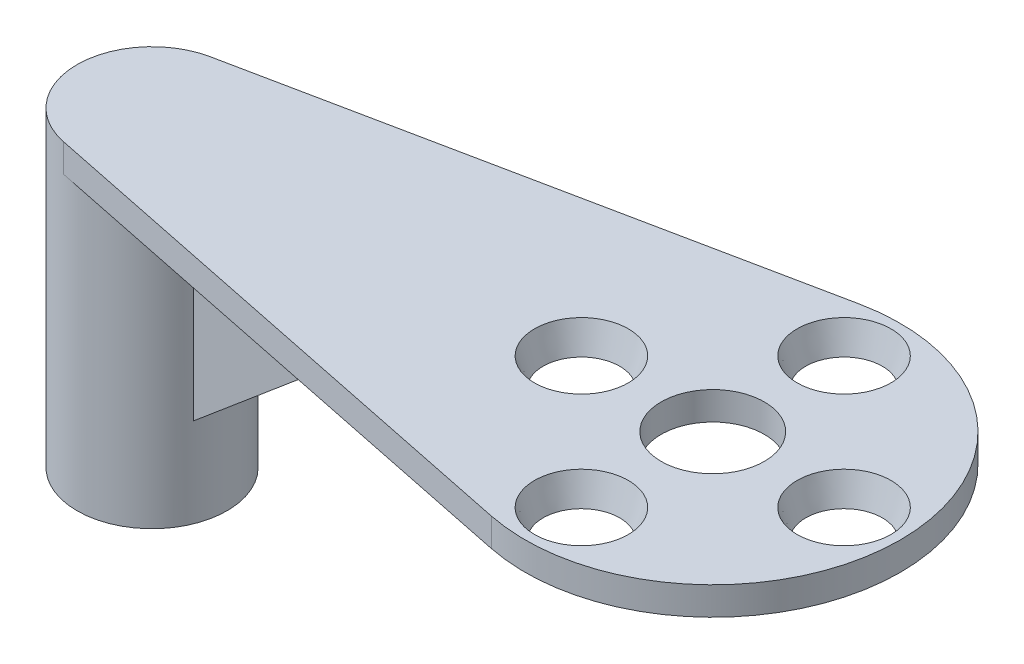
from build123d import *
from build123d.topology import SkipClean

# Parameters (mm, degrees)
CROQUIS1_R                      = 1.6
CROQUIS1_R_2                    = 2.75
SALIENTE_EXTRUIR1_DEPTH         = 1.5
SALIENTE_EXTRUIR3_START         = 15.1
CROQUIS3_R                      = 4
SALIENTE_EXTRUIR3_DEPTH         = 15.1
CROQUIS4_R                      = 3.1
CORTAR_EXTRUIR1_DEPTH           = 7.87
SALIENTE_EXTRUIR4_START         = -0.85
CROQUIS4_3_R                    = 3.1
CROQUIS4_3_R_2                  = 2.5
SALIENTE_EXTRUIR4_DEPTH         = 6.17
CROQUIS5_R                      = 2.5
CORTAR_EXTRUIR3_DEPTH           = 1.5
CORTAR_EXTRUIR3_DRAFT           = -17
CORTAR_EXTRUIR3_PROFILE_2_DEPTH = 1.5
CORTAR_EXTRUIR3_PROFILE_2_DRAFT = -17
CORTAR_EXTRUIR3_PROFILE_3_DEPTH = 1.5
CORTAR_EXTRUIR3_PROFILE_3_DRAFT = -17
CORTAR_EXTRUIR3_PROFILE_4_DEPTH = 1.5
CORTAR_EXTRUIR3_PROFILE_4_DRAFT = -17
NERVIO1_REACH                   = 45.809
CROQUIS6_WALL_W                 = 105.302560272
CROQUIS6_WALL_H                 = 3


with BuildPart() as part:
    # Croquis1 → Saliente-Extruir1 (new body)
    with BuildSketch(Plane(origin=(0, 0, 0), x_dir=(1, 0, 0), z_dir=(0, 1, 0))):
        with BuildLine():
            Line((-0.802944128, 3.918581469), (27.882639679, 9.796453672))
            ThreePointArc((27.882639679, 9.796453672), (39.89, 0), (27.882639679, -9.796453672))
            Line((27.882639679, -9.796453672), (-0.802944128, -3.918581469))
            ThreePointArc((-0.802944128, -3.918581469), (-4, 0), (-0.802944128, 3.918581469))
        make_face()
        with Locations(Location((29.89, 7, 0), (0, 0, 270))):
            Circle(CROQUIS1_R, mode=Mode.SUBTRACT)
        with Locations(Location((36.89, 0, 0), (0, 0, 270))):
            Circle(CROQUIS1_R, mode=Mode.SUBTRACT)
        with Locations(Location((29.89, -7, 0), (0, 0, 270))):
            Circle(CROQUIS1_R, mode=Mode.SUBTRACT)
        with Locations(Location((22.89, 0, 0), (0, 0, 270))):
            Circle(CROQUIS1_R, mode=Mode.SUBTRACT)
        with Locations(Location((29.89, 0, 0), (0, 0, 270))):
            Circle(CROQUIS1_R_2, mode=Mode.SUBTRACT)
    extrude(amount=SALIENTE_EXTRUIR1_DEPTH)

    # Croquis3 → Saliente-Extruir3 (add)
    with SkipClean():  # the faces are left unmerged after this step: merging them gives an invalid solid
        with BuildSketch(Plane.XZ.offset(SALIENTE_EXTRUIR3_START)):
            with Locations(Location((0, 0, 0), (0, 0, 258.419996521))):
                Circle(CROQUIS3_R)
        extrude(amount=-SALIENTE_EXTRUIR3_DEPTH)

    # Croquis4 → Cortar-Extruir1 (cut)
    with SkipClean():  # the faces are left unmerged after this step: merging them gives an invalid solid
        with BuildSketch(Plane.XZ.offset(15.1)):
            with Locations(Location((0, 0, 0), (0, 0, 270))):
                Circle(CROQUIS4_R)
        extrude(amount=-CORTAR_EXTRUIR1_DEPTH, mode=Mode.SUBTRACT)

    # Croquis4<3> → Saliente-Extruir4 (add)
    with SkipClean():  # the faces are left unmerged after this step: merging them gives an invalid solid
        with BuildSketch(Plane.XZ.offset(15.1).offset(SALIENTE_EXTRUIR4_START)):
            with Locations(Location((0, 0, 0), (0, 0, 270))):
                Circle(CROQUIS4_3_R)
            with Locations(Location((0, 0, 0), (0, 0, 270))):
                Circle(CROQUIS4_3_R_2, mode=Mode.SUBTRACT)
        extrude(amount=-SALIENTE_EXTRUIR4_DEPTH)


with BuildPart() as cortar_extruir3_tool:
    # Croquis5 → Cortar-Extruir3 (with draft: the straight prism first)
    with BuildSketch(Plane(origin=(0, 1.5, 0), x_dir=(1, 0, 0), z_dir=(0, 1, 0))):
        with Locations((29.89, 7)):
            Circle(CROQUIS5_R)
    extrude(amount=-CORTAR_EXTRUIR3_DEPTH)
    # Cortar-Extruir3: the draft: its side faces are tilted about the plane it starts from
    cortar_extruir3_sides = [cortar_extruir3_tool.faces().sort_by_distance(p)[0] for p in [
        (27.39, 0.75, -7),
    ]]
    draft(cortar_extruir3_sides, Plane(origin=(0, 1.5, 0), x_dir=(1, 0, 0), z_dir=(0, 1, 0)), CORTAR_EXTRUIR3_DRAFT)


with BuildPart() as part_1:
    add(part.part)

    # Cortar-Extruir3: cut by cortar_extruir3_tool
    add(cortar_extruir3_tool.part, mode=Mode.SUBTRACT)


with BuildPart() as cortar_extruir3_profile_2_tool:
    # Croquis5 → Cortar-Extruir3 profile 2 (with draft: the straight prism first)
    with BuildSketch(Plane(origin=(0, 1.5, 0), x_dir=(1, 0, 0), z_dir=(0, 1, 0))):
        with Locations((36.89, 0)):
            Circle(CROQUIS5_R)
    extrude(amount=-CORTAR_EXTRUIR3_PROFILE_2_DEPTH)
    # Cortar-Extruir3 profile 2: the draft: its side faces are tilted about the plane it starts from
    cortar_extruir3_profile_2_sides = [cortar_extruir3_profile_2_tool.faces().sort_by_distance(p)[0] for p in [
        (34.39, 0.75, 0),
    ]]
    draft(cortar_extruir3_profile_2_sides, Plane(origin=(0, 1.5, 0), x_dir=(1, 0, 0), z_dir=(0, 1, 0)), CORTAR_EXTRUIR3_PROFILE_2_DRAFT)


with BuildPart() as part_2:
    add(part_1.part)

    # Cortar-Extruir3 profile 2: cut by cortar_extruir3_profile_2_tool
    add(cortar_extruir3_profile_2_tool.part, mode=Mode.SUBTRACT)


with BuildPart() as cortar_extruir3_profile_3_tool:
    # Croquis5 → Cortar-Extruir3 profile 3 (with draft: the straight prism first)
    with BuildSketch(Plane(origin=(0, 1.5, 0), x_dir=(1, 0, 0), z_dir=(0, 1, 0))):
        with Locations((29.89, -7)):
            Circle(CROQUIS5_R)
    extrude(amount=-CORTAR_EXTRUIR3_PROFILE_3_DEPTH)
    # Cortar-Extruir3 profile 3: the draft: its side faces are tilted about the plane it starts from
    cortar_extruir3_profile_3_sides = [cortar_extruir3_profile_3_tool.faces().sort_by_distance(p)[0] for p in [
        (27.39, 0.75, 7),
    ]]
    draft(cortar_extruir3_profile_3_sides, Plane(origin=(0, 1.5, 0), x_dir=(1, 0, 0), z_dir=(0, 1, 0)), CORTAR_EXTRUIR3_PROFILE_3_DRAFT)


with BuildPart() as part_3:
    add(part_2.part)

    # Cortar-Extruir3 profile 3: cut by cortar_extruir3_profile_3_tool
    add(cortar_extruir3_profile_3_tool.part, mode=Mode.SUBTRACT)


with BuildPart() as cortar_extruir3_profile_4_tool:
    # Croquis5 → Cortar-Extruir3 profile 4 (with draft: the straight prism first)
    with BuildSketch(Plane(origin=(0, 1.5, 0), x_dir=(1, 0, 0), z_dir=(0, 1, 0))):
        with Locations((22.89, 0)):
            Circle(CROQUIS5_R)
    extrude(amount=-CORTAR_EXTRUIR3_PROFILE_4_DEPTH)
    # Cortar-Extruir3 profile 4: the draft: its side faces are tilted about the plane it starts from
    cortar_extruir3_profile_4_sides = [cortar_extruir3_profile_4_tool.faces().sort_by_distance(p)[0] for p in [
        (20.39, 0.75, 0),
    ]]
    draft(cortar_extruir3_profile_4_sides, Plane(origin=(0, 1.5, 0), x_dir=(1, 0, 0), z_dir=(0, 1, 0)), CORTAR_EXTRUIR3_PROFILE_4_DRAFT)


with BuildPart() as part_4:
    add(part_3.part)

    # Cortar-Extruir3 profile 4: cut by cortar_extruir3_profile_4_tool
    add(cortar_extruir3_profile_4_tool.part, mode=Mode.SUBTRACT)

    # Croquis6 wall → Nervio1 (add, up to next)
    with BuildSketch(Plane(origin=(10, -5.05, 0), x_dir=(-0.765076505499, -0.643939392128, 0), z_dir=(0.643939392128, -0.765076505499, 0)), mode=Mode.PRIVATE) as nervio1_sk1:
        Rectangle(CROQUIS6_WALL_W, CROQUIS6_WALL_H)
    nervio1_tool1 = extrude(nervio1_sk1.sketch, amount=-NERVIO1_REACH, mode=Mode.PRIVATE) - part_4.part
    add(nervio1_tool1.solids().sort_by_distance((10, -5.05, 0))[0])


solid = part_4.part
